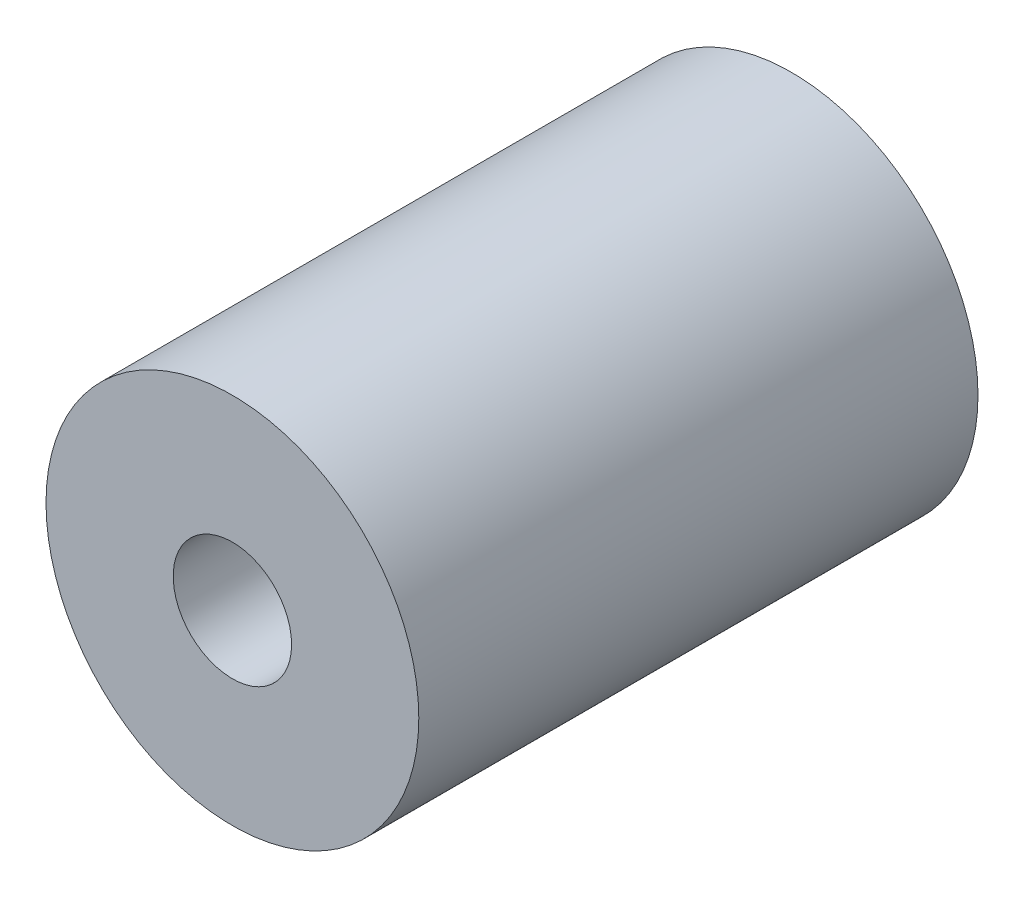
from build123d import *

# Parameters (mm, degrees)
CROQUIS1_R              = 10
CROQUIS1_R_2            = 3.175
SALIENTE_EXTRUIR1_DEPTH = 30


with BuildPart() as part:
    # Croquis1 → Saliente-Extruir1 (new body)
    with BuildSketch(Plane.XY):
        Circle(CROQUIS1_R)
        Circle(CROQUIS1_R_2, mode=Mode.SUBTRACT)
    extrude(amount=SALIENTE_EXTRUIR1_DEPTH)


solid = part.part
